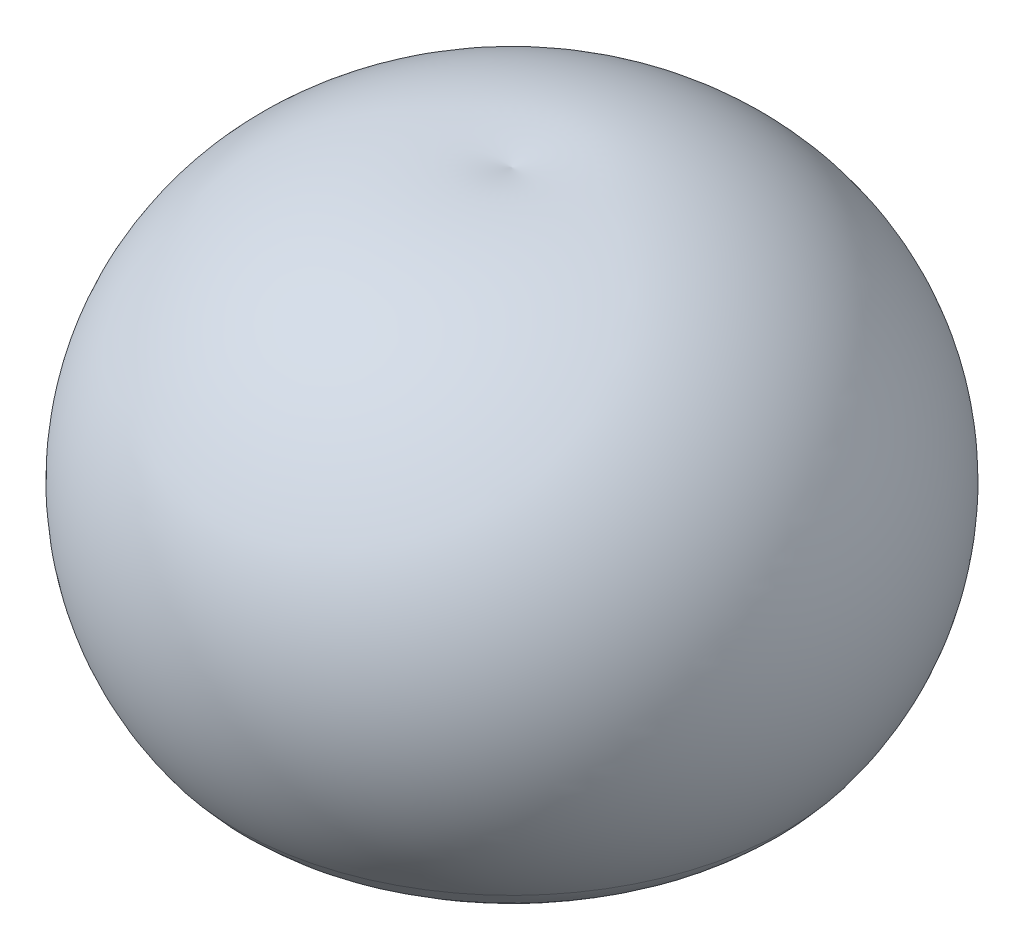
from build123d import *


with BuildPart() as part:
    # Sketch4 → Revolve2 (revolve)
    with BuildSketch(Plane.XY):
        with BuildLine():
            Line((0, 1220.925535032), (0, 2005.281925007))
            ThreePointArc((0, 2005.281925007), (1405.84287245, 1399.081564229), (1349.875844739, -130.866392806))
            ThreePointArc((1349.875844739, -130.866392806), (531.712504651, -327.769847782), (155.808966491, 425.130379104))
            ThreePointArc((155.808966491, 425.130379104), (217.264549121, 407.671961537), (281.100087394, 405.101157427))
            ThreePointArc((281.100087394, 405.101157427), (311.692829481, 871.982228947), (0, 1220.925535032))
        make_face()
    revolve(axis=Axis((0, 1220.925535032, 0), (0, 1, 0)))


solid = part.part
